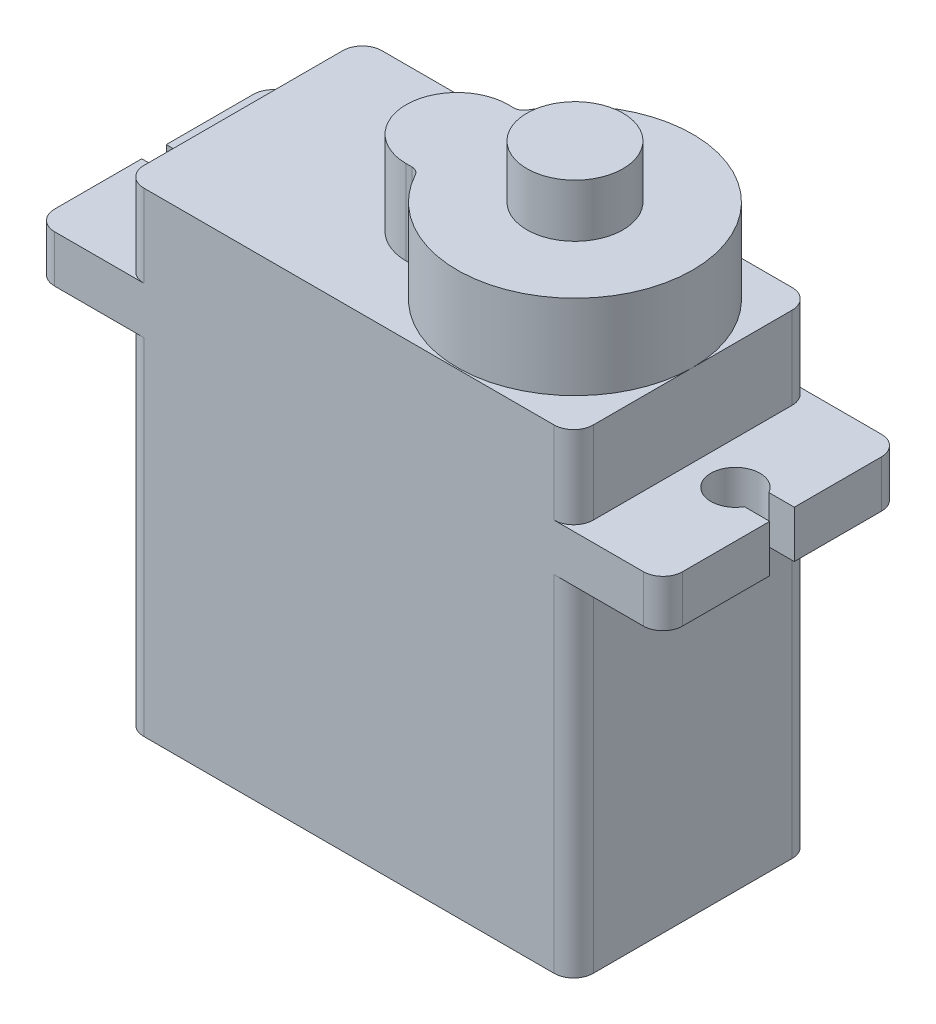
from build123d import *

# Parameters (mm, degrees)
ESBO_O2_W                  = 22.9
ESBO_O2_H                  = 12.13
RESSALTO_EXTRUS_O1_DEPTH   = 17.35
ESBO_O3_W                  = 32
ESBO_O3_H                  = 12.13
RESSALTO_EXTRUS_O2_DEPTH   = 2.4
ESBO_O4_W                  = 22.9
ESBO_O4_H                  = 12.13
RESSALTO_EXTRUS_O3_DEPTH   = 4.45
CORTE_EXTRUS_O1_DEPTH      = 2.4
RESSALTO_EXTRUS_O4_DEPTH   = 4.3
ESBO_O7_R                  = 2.45
RESSALTO_EXTRUS_O5_DEPTH   = 2.7
CORTE_EXTRUS_O2_DEPTH      = 1
CORTE_EXTRUS_O2_DEPTH_BACK = 16
ESBO_O10_W                 = 9.190370446
ESBO_O10_H                 = 13.482765879
ESBO_O10_W_2               = 7.294178248
ESBO_O10_H_2               = 14.557386271
RESSALTO_EXTRUS_O7_DEPTH   = 2.4
FILETE1_R                  = 1


with BuildPart() as part:
    # Esboço2 → Ressalto-extrusão1 (new body)
    with BuildSketch(Plane(origin=(0, 0, 0), x_dir=(1, 0, 0), z_dir=(0, 1, 0))):
        Rectangle(ESBO_O2_W, ESBO_O2_H)
    extrude(amount=RESSALTO_EXTRUS_O1_DEPTH)

    # Esboço3 → Ressalto-extrusão2 (add)
    with BuildSketch(Plane(origin=(0, 17.35, 0), x_dir=(1, 0, 0), z_dir=(0, 1, 0))):
        Rectangle(ESBO_O3_W, ESBO_O3_H)
    extrude(amount=RESSALTO_EXTRUS_O2_DEPTH)

    # Esboço4 → Ressalto-extrusão3 (add)
    with BuildSketch(Plane(origin=(0, 19.75, 0), x_dir=(1, 0, 0), z_dir=(0, 1, 0))):
        Rectangle(ESBO_O4_W, ESBO_O4_H)
    extrude(amount=RESSALTO_EXTRUS_O3_DEPTH)

    # Esboço5 → Corte-extrusão1 (cut)
    with BuildSketch(Plane(origin=(0, 19.75, 0), x_dir=(1, 0, 0), z_dir=(0, 1, 0))):
        with BuildLine():
            Line((-16, -0.625), (-16, 0.625))
            Line((-16, 0.625), (-14.707531755, 0.625))
            ThreePointArc((-14.707531755, 0.625), (-12.375, 0), (-14.707531755, -0.625))
            Line((-14.707531755, -0.625), (-16, -0.625))
        make_face()
        with BuildLine():
            Line((14.707531755, -0.625), (16, -0.625))
            Line((16, -0.625), (16, 0.625))
            Line((16, 0.625), (14.707531755, 0.625))
            ThreePointArc((14.707531755, 0.625), (12.375, 0), (14.707531755, -0.625))
        make_face()
    extrude(amount=-CORTE_EXTRUS_O1_DEPTH, mode=Mode.SUBTRACT)

    # Esboço6 → Ressalto-extrusão4 (add)
    with BuildSketch(Plane(origin=(0, 24.2, 0), x_dir=(1, 0, 0), z_dir=(0, 1, 0))):
        with BuildLine():
            Line((-0.55, -2.6), (-0.263142743, -2.6))
            ThreePointArc((-0.263142743, -2.6), (-0.007438587, -2.670331076), (0.176329776, -2.861538462))
            ThreePointArc((0.176329776, -2.861538462), (11.45, 0), (0.176329776, 2.861538462))
            ThreePointArc((0.176329776, 2.861538462), (-0.007438587, 2.670331076), (-0.263142743, 2.6))
            Line((-0.263142743, 2.6), (-0.55, 2.6))
            ThreePointArc((-0.55, 2.6), (-3.15, 0), (-0.55, -2.6))
        make_face()
    extrude(amount=RESSALTO_EXTRUS_O4_DEPTH)

    # Esboço7 → Ressalto-extrusão5 (add)
    with BuildSketch(Plane(origin=(0, 28.5, 0), x_dir=(1, 0, 0), z_dir=(0, 1, 0))):
        with Locations(Location((5.45, 0, 0), (0, 0, 90))):
            Circle(ESBO_O7_R)
    extrude(amount=RESSALTO_EXTRUS_O5_DEPTH)

    # Esboço10 → Corte-extrusão2 (cut, two sides: drawn at the far end of the back side and taken through both)
    with BuildSketch(Plane(origin=(0, 28.5, 0), x_dir=(1, 0, 0), z_dir=(0, 1, 0)).offset(-CORTE_EXTRUS_O2_DEPTH_BACK)):
        with Locations((16.045185223, -0.676382939)):
            Rectangle(ESBO_O10_W, ESBO_O10_H)
        with Locations((-15.097089124, -1.213693136)):
            Rectangle(ESBO_O10_W_2, ESBO_O10_H_2)
    extrude(amount=CORTE_EXTRUS_O2_DEPTH + CORTE_EXTRUS_O2_DEPTH_BACK, mode=Mode.SUBTRACT)

    # Esboço12 → Ressalto-extrusão7 (add)
    with BuildSketch(Plane(origin=(0, 17.6, 0), x_dir=(1, 0, 0), z_dir=(0, 1, 0))):
        with BuildLine():
            Line((16, 0.625), (14.707531755, 0.625))
            ThreePointArc((14.707531755, 0.625), (12.375, 0), (14.707531755, -0.625))
            Line((14.707531755, -0.625), (16, -0.625))
            Line((16, -0.625), (16, -6.065))
            Line((16, -6.065), (11.45, -6.065))
            Line((11.45, -6.065), (11.45, 6.065))
            Line((11.45, 6.065), (16, 6.065))
            Line((16, 6.065), (16, 0.625))
        make_face()
        with BuildLine():
            Line((-16, -0.625), (-16, -6.065))
            Line((-16, -6.065), (-11.45, -6.065))
            Line((-11.45, -6.065), (-11.45, 6.065))
            Line((-11.45, 6.065), (-16, 6.065))
            Line((-16, 6.065), (-16, 0.625))
            Line((-16, 0.625), (-14.707531755, 0.625))
            ThreePointArc((-14.707531755, 0.625), (-12.375, 0), (-14.707531755, -0.625))
            Line((-14.707531755, -0.625), (-16, -0.625))
        make_face()
    extrude(amount=RESSALTO_EXTRUS_O7_DEPTH)

    # Filete1
    filete1_edges = [part.edges().sort_by_distance(p)[0] for p in [
        (11.45, 8.8, 6.065),
        (11.45, 8.8, -6.065),
        (16, 18.8, -6.065),
        (16, 18.8, 6.065),
        (-11.45, 8.8, 6.065),
        (-11.45, 8.8, -6.065),
        (-16, 18.8, 6.065),
        (-16, 18.8, -6.065),
        (-11.45, 22.1, -6.065),
        (11.45, 22.1, -6.065),
        (11.45, 22.1, 6.065),
        (-11.45, 22.1, 6.065),
    ]]
    fillet(filete1_edges, radius=FILETE1_R)


solid = part.part
